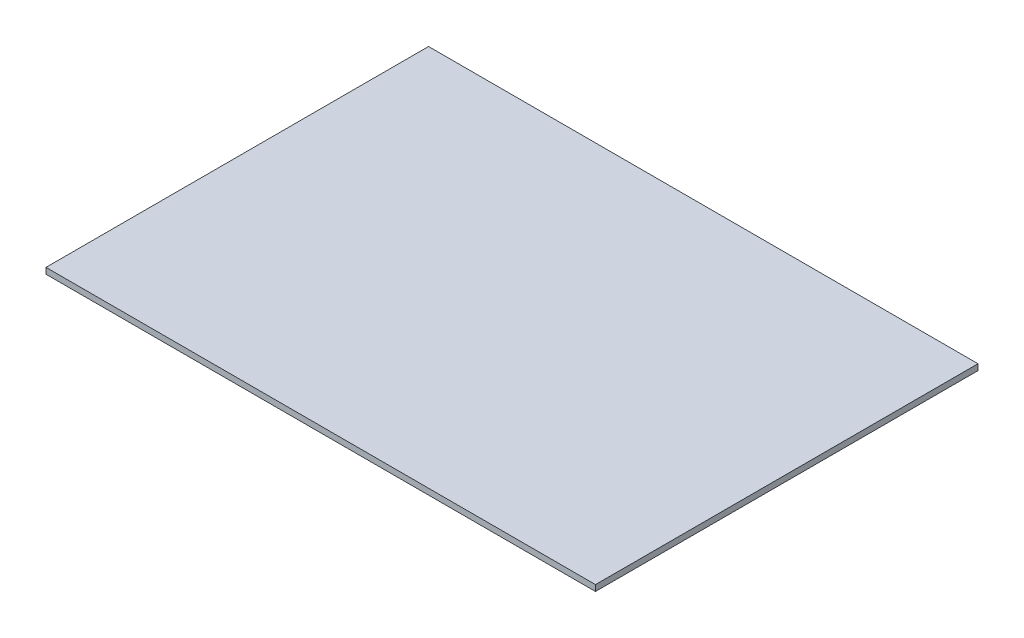
from build123d import *

# Parameters (mm, degrees)
SKETCH1_W      = 165.1
SKETCH1_H      = 114.94
EXTRUDE1_DEPTH = 1.8


with BuildPart() as part:
    # Sketch1 → Extrude1 (new body)
    with BuildSketch(Plane(origin=(0, 0, 0), x_dir=(1, 0, 0), z_dir=(0, 1, 0))):
        with Locations((82.55, 57.47)):
            Rectangle(SKETCH1_W, SKETCH1_H)
    extrude(amount=-EXTRUDE1_DEPTH)


solid = part.part
